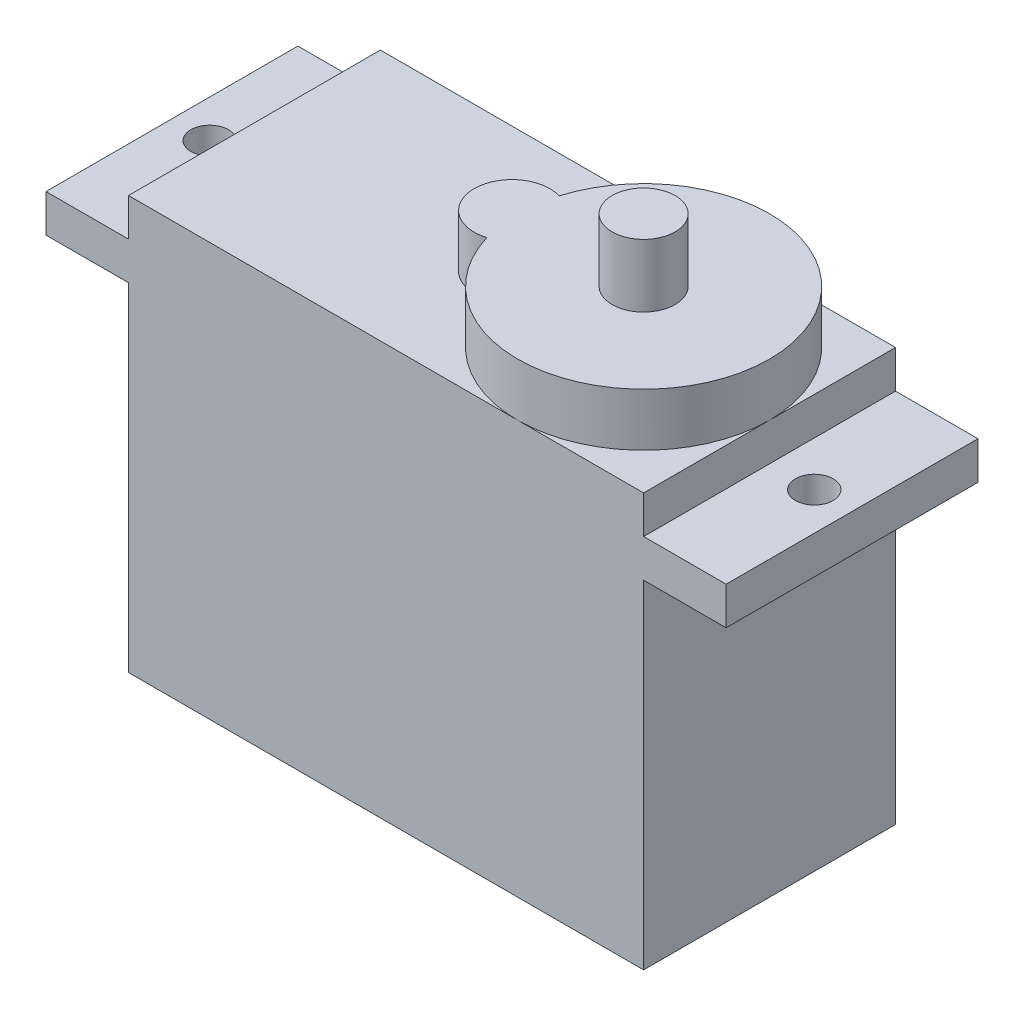
from build123d import *

# Parameters (mm, degrees)
SKETCH1_W           = 40.9
SKETCH1_H           = 26.8
BOSS_EXTRUDE1_DEPTH = 10
SKETCH2_W           = 54
SKETCH2_H           = 20
BOSS_EXTRUDE2_DEPTH = 3
SKETCH3_R           = 1.5
CUT_EXTRUDE1_DEPTH  = 3
SKETCH4_W           = 40.9
SKETCH4_H           = 20
BOSS_EXTRUDE3_DEPTH = 3
BOSS_EXTRUDE4_DEPTH = 4.2
SKETCH6_R           = 2.5
BOSS_EXTRUDE5_DEPTH = 5


with BuildPart() as part:
    # Sketch1 → Boss-Extrude1 (new, symmetric)
    with BuildSketch(Plane.XY):
        Rectangle(SKETCH1_W, SKETCH1_H)
    extrude(amount=BOSS_EXTRUDE1_DEPTH, both=True)

    # Sketch2 → Boss-Extrude2 (add)
    with BuildSketch(Plane(origin=(0, 13.4, 0), x_dir=(1, 0, 0), z_dir=(0, 1, 0))):
        Rectangle(SKETCH2_W, SKETCH2_H)
    extrude(amount=BOSS_EXTRUDE2_DEPTH)

    # Sketch3 → Cut-Extrude1 (cut)
    with BuildSketch(Plane(origin=(0, 16.4, 0), x_dir=(1, 0, 0), z_dir=(0, 1, 0))):
        with Locations(Location((-24, 0, 0), (0, 0, 180))):
            Circle(SKETCH3_R)
        with Locations(Location((24, 0, 0), (0, 0, 180))):
            Circle(SKETCH3_R)
    extrude(amount=-CUT_EXTRUDE1_DEPTH, mode=Mode.SUBTRACT)

    # Sketch4 → Boss-Extrude3 (add)
    with BuildSketch(Plane(origin=(0, 16.4, 0), x_dir=(1, 0, 0), z_dir=(0, 1, 0))):
        Rectangle(SKETCH4_W, SKETCH4_H)
    extrude(amount=BOSS_EXTRUDE3_DEPTH)

    # Sketch5 → Boss-Extrude4 (add)
    with BuildSketch(Plane(origin=(0, 19.4, 0), x_dir=(1, 0, 0), z_dir=(0, 1, 0))):
        with BuildLine():
            ThreePointArc((0.870933014, -2.870797047), (20.45, 0), (0.870933014, 2.870797047))
            ThreePointArc((0.870933014, 2.870797047), (-3, 0), (0.870933014, -2.870797047))
        make_face()
    extrude(amount=BOSS_EXTRUDE4_DEPTH)

    # Sketch6 → Boss-Extrude5 (add)
    with BuildSketch(Plane(origin=(0, 23.6, 0), x_dir=(1, 0, 0), z_dir=(0, 1, 0))):
        with Locations(Location((10.45, 0, 0), (0, 0, 270))):
            Circle(SKETCH6_R)
    extrude(amount=BOSS_EXTRUDE5_DEPTH)


solid = part.part
